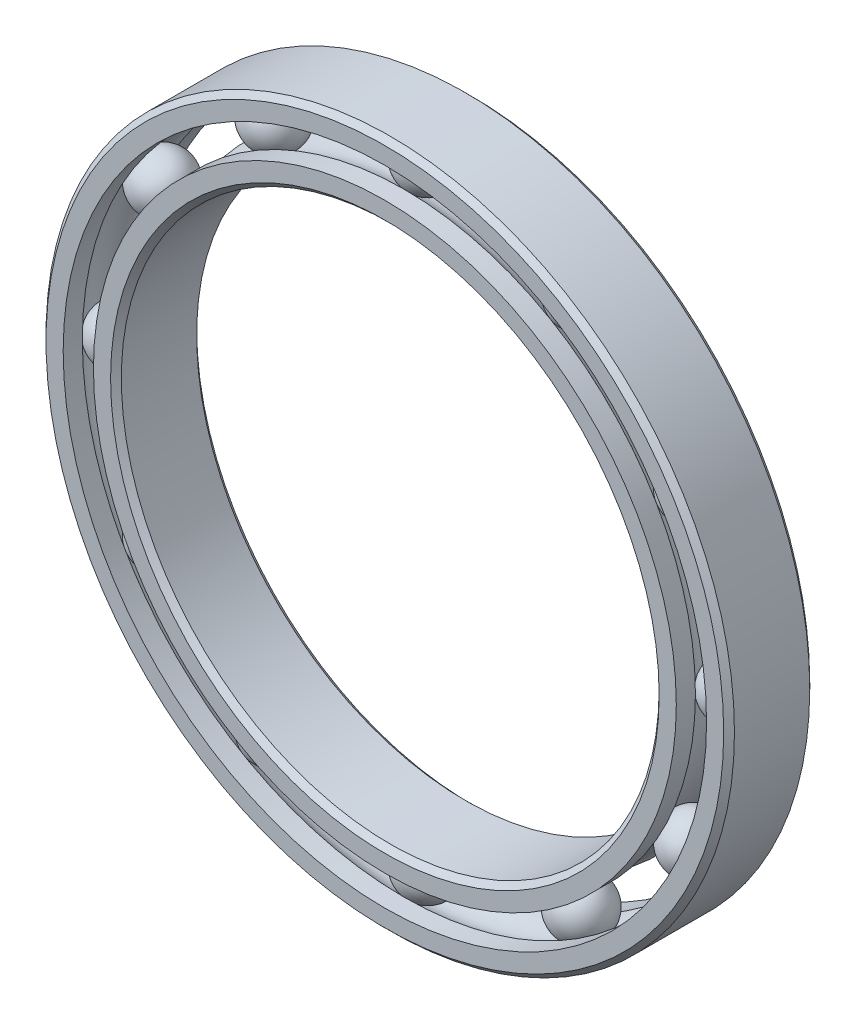
from build123d import *

# Parameters (mm, degrees)
CIRPATTERN1_COUNT = 12


with BuildPart() as part:
    # Sketch1 → Revolve1 (revolve)
    with BuildSketch(Plane(origin=(0, 0, 0), x_dir=(0, 0, -1), z_dir=(1, 0, 0))):
        with BuildLine():
            Line((1.75, 16), (-1.75, 16))
            Line((-1.75, 16), (-2, 15.75))
            Line((-2, 15.75), (-2, 14.953296703))
            Line((-2, 14.953296703), (-1.111111111, 14.953296703))
            ThreePointArc((-1.111111111, 14.953296703), (0, 15.564988271), (1.111111111, 14.953296703))
            Line((1.111111111, 14.953296703), (2, 14.953296703))
            Line((2, 14.953296703), (2, 15.75))
            Line((2, 15.75), (1.75, 16))
        make_face()
    revolve(axis=Axis((0, 0, 2), (0, 0, -1)))


with BuildPart() as body_2:
    # Sketch3 → Revolve3 (revolve)
    with BuildSketch(Plane(origin=(0, 0, 0), x_dir=(0, 0, -1), z_dir=(1, 0, 0))):
        with BuildLine():
            Line((-2, 13.546703297), (-1.111111111, 13.546703297))
            ThreePointArc((-1.111111111, 13.546703297), (0, 12.935011729), (1.111111111, 13.546703297))
            Line((1.111111111, 13.546703297), (2, 13.546703297))
            Line((2, 13.546703297), (2, 12.75))
            Line((2, 12.75), (1.75, 12.5))
            Line((1.75, 12.5), (-1.75, 12.5))
            Line((-1.75, 12.5), (-2, 12.75))
            Line((-2, 12.75), (-2, 13.546703297))
        make_face()
    revolve(axis=Axis((0, 0, 2), (0, 0, -1)))


with BuildPart() as body_3:
    # Sketch4 → Revolve4 (revolve)
    with BuildSketch(Plane(origin=(0, 0, 0), x_dir=(0, 0, -1), z_dir=(1, 0, 0))):
        with BuildLine():
            Line((-1.314988271, 14.25), (1.314988271, 14.25))
            ThreePointArc((1.314988271, 14.25), (0, 15.564988271), (-1.314988271, 14.25))
        make_face()
    revolve(axis=Axis((0, 14.25, 1.314988271), (0, 0, -1)))


with BuildPart() as cirpattern1_1:
    # CirPattern1: pattern copy
    add(body_3.part.rotate(Axis((0, 0, -2), (0, 0, 1)), 1 * 360 / CIRPATTERN1_COUNT))


with BuildPart() as cirpattern1_2:
    # CirPattern1: pattern copy
    add(body_3.part.rotate(Axis((0, 0, -2), (0, 0, 1)), 2 * 360 / CIRPATTERN1_COUNT))


with BuildPart() as cirpattern1_3:
    # CirPattern1: pattern copy
    add(body_3.part.rotate(Axis((0, 0, -2), (0, 0, 1)), 3 * 360 / CIRPATTERN1_COUNT))


with BuildPart() as cirpattern1_4:
    # CirPattern1: pattern copy
    add(body_3.part.rotate(Axis((0, 0, -2), (0, 0, 1)), 4 * 360 / CIRPATTERN1_COUNT))


with BuildPart() as cirpattern1_5:
    # CirPattern1: pattern copy
    add(body_3.part.rotate(Axis((0, 0, -2), (0, 0, 1)), 5 * 360 / CIRPATTERN1_COUNT))


with BuildPart() as cirpattern1_6:
    # CirPattern1: pattern copy
    add(body_3.part.rotate(Axis((0, 0, -2), (0, 0, 1)), 6 * 360 / CIRPATTERN1_COUNT))


with BuildPart() as cirpattern1_7:
    # CirPattern1: pattern copy
    add(body_3.part.rotate(Axis((0, 0, -2), (0, 0, 1)), 7 * 360 / CIRPATTERN1_COUNT))


with BuildPart() as cirpattern1_8:
    # CirPattern1: pattern copy
    add(body_3.part.rotate(Axis((0, 0, -2), (0, 0, 1)), 8 * 360 / CIRPATTERN1_COUNT))


with BuildPart() as cirpattern1_9:
    # CirPattern1: pattern copy
    add(body_3.part.rotate(Axis((0, 0, -2), (0, 0, 1)), 9 * 360 / CIRPATTERN1_COUNT))


with BuildPart() as cirpattern1_10:
    # CirPattern1: pattern copy
    add(body_3.part.rotate(Axis((0, 0, -2), (0, 0, 1)), 10 * 360 / CIRPATTERN1_COUNT))


with BuildPart() as cirpattern1_11:
    # CirPattern1: pattern copy
    add(body_3.part.rotate(Axis((0, 0, -2), (0, 0, 1)), 11 * 360 / CIRPATTERN1_COUNT))


solid = Compound([part.part, body_2.part, body_3.part, cirpattern1_1.part, cirpattern1_2.part, cirpattern1_3.part, cirpattern1_4.part, cirpattern1_5.part, cirpattern1_6.part, cirpattern1_7.part, cirpattern1_8.part, cirpattern1_9.part, cirpattern1_10.part, cirpattern1_11.part])
